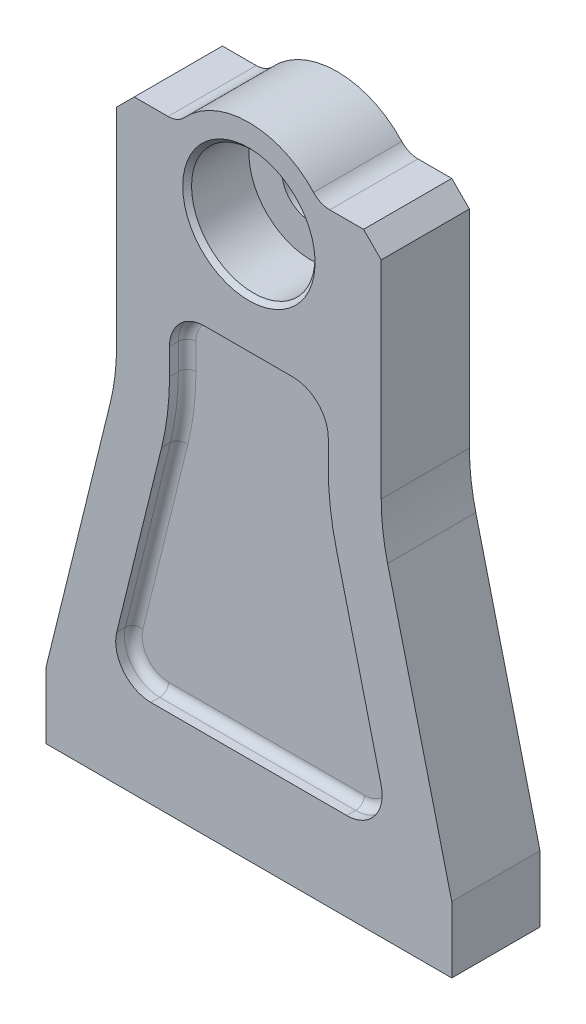
from build123d import *

# Parameters (mm, degrees)
SKETCH1_R                         = 6.5
BOSS_EXTRUDE1_DEPTH               = 10
SKETCH2_R                         = 14
CUT_EXTRUDE1_DEPTH                = 14
CHAMFER1_SIZE                     = 1
CHAMFER2_SIZE                     = 4
FILLET1_R                         = 5
CUT_EXTRUDE2_DEPTH                = 4
FILLET2_R                         = 2
FILLET2_OF_MIRROR1_R              = 2
M10X1_25_TAPPED_HOLE1_D           = 8.8
M10X1_25_TAPPED_HOLE1_DEPTH       = 20
M10X1_25_TAPPED_HOLE1_CSINK_D     = 10.05
M10X1_25_TAPPED_HOLE1_CSINK_ANGLE = 90
M10X1_25_TAPPED_HOLE1_TIP         = 2.643786724


with BuildPart() as part:
    # Sketch1 → Boss-Extrude1 (new, symmetric)
    with BuildSketch(Plane.XY):
        with BuildLine():
            Line((-46, 0), (46, 0))
            Line((46, 0), (46, 15))
            Line((46, 15), (31.449256053, 74.112397284))
            ThreePointArc((31.449256053, 74.112397284), (30.363636327, 80.044097084), (30, 86.06334964))
            Line((30, 86.06334964), (30, 137))
            Line((30, 137), (16, 137))
            ThreePointArc((16, 137), (0, 145), (-16, 137))
            Line((-16, 137), (-30, 137))
            Line((-30, 137), (-30, 86.06334964))
            ThreePointArc((-30, 86.06334964), (-30.363636327, 80.044097084), (-31.449256053, 74.112397284))
            Line((-31.449256053, 74.112397284), (-46, 15))
            Line((-46, 15), (-46, 0))
        make_face()
        with Locations((0, 125)):
            Circle(SKETCH1_R, mode=Mode.SUBTRACT)
    extrude(amount=BOSS_EXTRUDE1_DEPTH, both=True)

    # Sketch2 → Cut-Extrude1 (cut)
    with BuildSketch(Plane.XY.offset(10)):
        with Locations((0, 125)):
            Circle(SKETCH2_R)
    extrude(amount=-CUT_EXTRUDE1_DEPTH, mode=Mode.SUBTRACT)

    # Chamfer1
    chamfer1_edges = [part.edges().sort_by_distance(p)[0] for p in [
        (-14, 125, 10),
    ]]
    chamfer(chamfer1_edges, length=CHAMFER1_SIZE)

    # Chamfer2
    chamfer2_edges = [part.edges().sort_by_distance(p)[0] for p in [
        (-30, 137, 0),
        (30, 137, 0),
    ]]
    chamfer(chamfer2_edges, length=CHAMFER2_SIZE)

    # Fillet1
    fillet1_edges = [part.edges().sort_by_distance(p)[0] for p in [
        (-16, 137, 0),
        (16, 137, 0),
    ]]
    fillet(fillet1_edges, radius=FILLET1_R)

    # Sketch3 → Cut-Extrude2 (cut)
    with BuildSketch(Plane.XY.offset(10)):
        with BuildLine():
            Line((-18, 92), (-18, 86.06334964))
            ThreePointArc((-18, 86.06334964), (-18.450909046, 78.59947647), (-19.797077506, 71.244168718))
            Line((-19.797077506, 71.244168718), (-29.971112298, 29.912152377))
            ThreePointArc((-29.971112298, 29.912152377), (-28.49970745, 23.065287193), (-22.202993266, 20))
            Line((-22.202993266, 20), (22.202993266, 20))
            ThreePointArc((22.202993266, 20), (28.49970745, 23.065287193), (29.971112298, 29.912152377))
            Line((29.971112298, 29.912152377), (19.797077506, 71.244168718))
            ThreePointArc((19.797077506, 71.244168718), (18.450909046, 78.59947647), (18, 86.06334964))
            Line((18, 86.06334964), (18, 92))
            ThreePointArc((18, 92), (15.656854249, 97.656854249), (10, 100))
            Line((10, 100), (-10, 100))
            ThreePointArc((-10, 100), (-15.656854249, 97.656854249), (-18, 92))
        make_face()
    cut_extrude2 = extrude(amount=-CUT_EXTRUDE2_DEPTH, mode=Mode.SUBTRACT)

    # Fillet2
    fillet2_edges = [part.edges().sort_by_distance(p)[0] for p in [
        (-28.49970745, 23.065287193, 6),
        (-24.884094902, 50.578160548, 6),
        (-18.450909046, 78.59947647, 6),
        (-18, 89.03167482, 6),
        (-15.656854249, 97.656854249, 6),
        (0, 100, 6),
        (15.656854249, 97.656854249, 6),
        (18, 89.03167482, 6),
        (18.450909046, 78.59947647, 6),
        (24.884094902, 50.578160548, 6),
        (28.49970745, 23.065287193, 6),
        (0, 20, 6),
    ]]
    fillet(fillet2_edges, radius=FILLET2_R)

    # Mirror1: Cut-Extrude2 across plane
    add(cut_extrude2.mirror(Plane.XY), mode=Mode.SUBTRACT)

    # Fillet2 of Mirror1
    fillet2_of_mirror1_edges = [part.edges().sort_by_distance(p)[0] for p in [
        (-28.49970745, 23.065287193, -6),
        (-24.884094902, 50.578160548, -6),
        (-18.450909046, 78.59947647, -6),
        (-18, 89.03167482, -6),
        (-15.656854249, 97.656854249, -6),
        (0, 100, -6),
        (15.656854249, 97.656854249, -6),
        (18, 89.03167482, -6),
        (18.450909046, 78.59947647, -6),
        (24.884094902, 50.578160548, -6),
        (28.49970745, 23.065287193, -6),
        (0, 20, -6),
    ]]
    fillet(fillet2_of_mirror1_edges, radius=FILLET2_OF_MIRROR1_R)

    # M10x1.25 Tapped Hole1
    with Locations(Plane(origin=(0, 0, 0), x_dir=(-1, 0, 0), z_dir=(0, -1, 0))):
        with Locations((-30, 0), (30, 0)):
            CounterSinkHole(M10X1_25_TAPPED_HOLE1_D / 2, M10X1_25_TAPPED_HOLE1_CSINK_D / 2, depth=M10X1_25_TAPPED_HOLE1_DEPTH, counter_sink_angle=M10X1_25_TAPPED_HOLE1_CSINK_ANGLE)
            with Locations((0, 0, -(M10X1_25_TAPPED_HOLE1_DEPTH + M10X1_25_TAPPED_HOLE1_TIP / 2))):  # 118° drill point
                Cone(0, M10X1_25_TAPPED_HOLE1_D / 2, M10X1_25_TAPPED_HOLE1_TIP, mode=Mode.SUBTRACT)


solid = part.part
